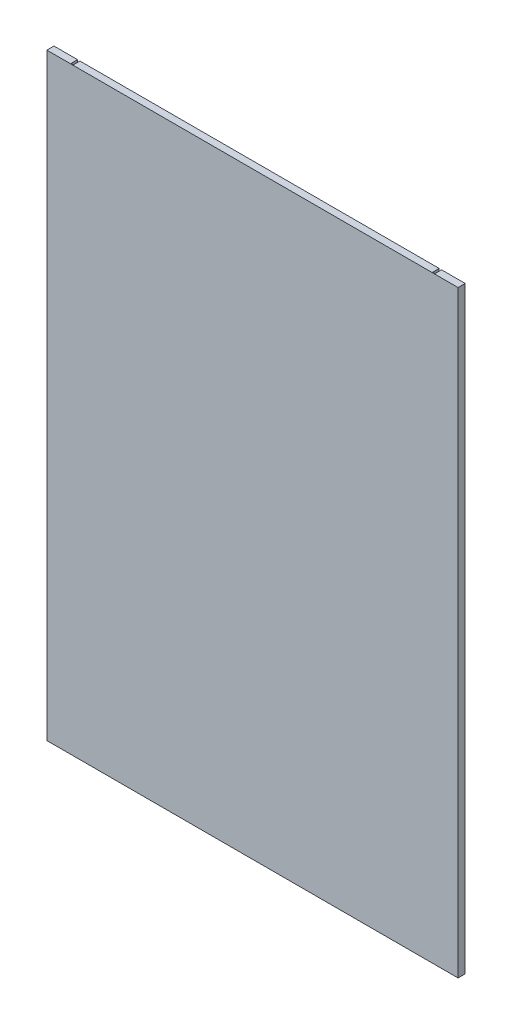
from build123d import *

# Parameters (mm, degrees)
BOSS_EXTRUDE1_DEPTH = 253


with BuildPart() as part:
    # Sketch1 → Boss-Extrude1 (new body)
    with BuildSketch(Plane(origin=(0, 0, 0), x_dir=(1, 0, 0), z_dir=(0, 1, 0))):
        Polygon((-87, 0), (-87, 3), (-77, 3), (-77, 0.2), (-76, 0.2), (-76, 3), (76, 3), (76, 0.2), (77, 0.2), (77, 3), (87, 3), (87, 0), align=None)
    extrude(amount=BOSS_EXTRUDE1_DEPTH)


solid = part.part
